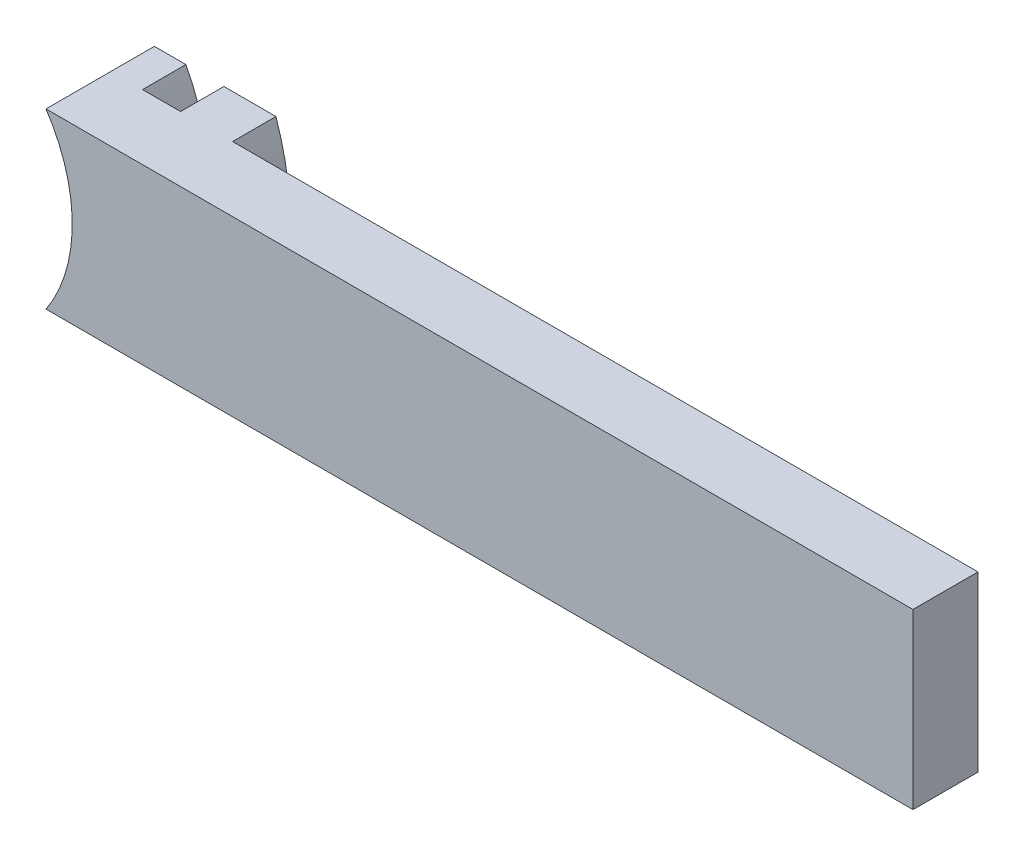
from build123d import *

# Parameters (mm, degrees)
BOSS_EXTRUDE1_DEPTH = 15
BOSS_EXTRUDE2_DEPTH = 10


with BuildPart() as part:
    # Sketch3 → Boss-Extrude1 (new body)
    with BuildSketch(Plane.XY):
        with BuildLine():
            Line((230, 20), (230, -20))
            Line((230, -20), (30, -20))
            ThreePointArc((30, -20), (36.055512755, 0), (30, 20))
            Line((30, 20), (230, 20))
        make_face()
    extrude(amount=-BOSS_EXTRUDE1_DEPTH)

    # Sketch6 → Boss-Extrude2 (add)
    with BuildSketch(Plane(origin=(0, 0, -15), x_dir=(-1, 0, 0), z_dir=(0, 0, -1))):
        with BuildLine():
            Line((-37.273180707, 20), (-30, 20))
            ThreePointArc((-30, 20), (-36.055512755, 0), (-30, -20))
            Line((-30, -20), (-37.273180707, -20))
            ThreePointArc((-37.273180707, -20), (-42.3, 0), (-37.273180707, 20))
        make_face()
        with BuildLine():
            Line((-46.043892103, 20), (-58.043892103, 20))
            ThreePointArc((-58.043892103, 20), (-61.392942676, 0), (-58.043892103, -20))
            Line((-58.043892103, -20), (-46.043892103, -20))
            ThreePointArc((-46.043892103, -20), (-50.2, 0), (-46.043892103, 20))
        make_face()
    extrude(amount=BOSS_EXTRUDE2_DEPTH)


solid = part.part
